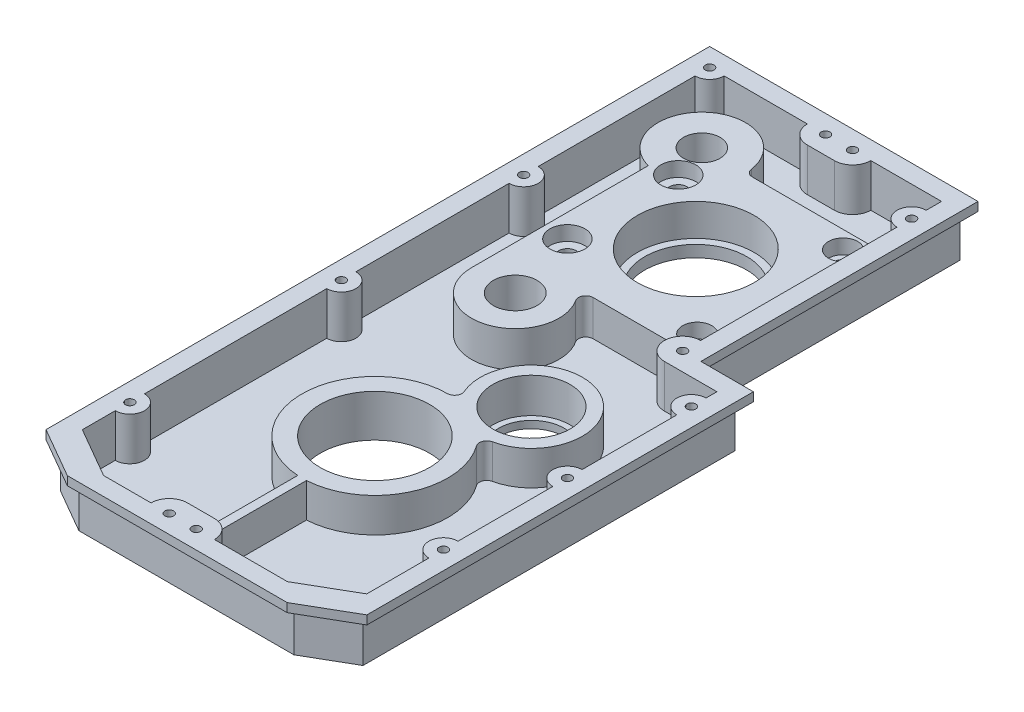
from build123d import *

# Parameters (mm, degrees)
SKETCH1_R           = 3
SKETCH1_R_2         = 12.5
SKETCH1_R_3         = 6
SKETCH1_R_4         = 37.5
SKETCH1_R_5         = 26.5
SKETCH1_R_6         = 35
BOSS_EXTRUDE1_DEPTH = 35
SKETCH1_6_R         = 6
SKETCH1_6_R_2       = 12.5
SKETCH1_6_R_3       = 35
CUT_EXTRUDE1_DEPTH  = 5
SKETCH1_7_R         = 15
CUT_EXTRUDE2_DEPTH  = 374.443770868
SKETCH1_8_R         = 40
SKETCH1_8_R_2       = 35
CUT_EXTRUDE3_DEPTH  = 27
BOSS_EXTRUDE2_START = -10
SKETCH1_10_R        = 3
BOSS_EXTRUDE2_DEPTH = 25
SKETCH1_11_R        = 10
SKETCH1_11_R_2      = 6
SKETCH1_11_R_3      = 12
CUT_EXTRUDE4_DEPTH  = 15
CUT_EXTRUDE6_DEPTH  = 29.5
BOSS_EXTRUDE3_START = -30
SKETCH1_15_R        = 26.5
SKETCH1_15_R_2      = 22.5
BOSS_EXTRUDE3_DEPTH = 5
SKETCH1_16_R        = 26.5
SKETCH1_16_R_2      = 37.5
CUT_EXTRUDE7_DEPTH  = 6
CUT_EXTRUDE8_DEPTH  = 10
CUT_EXTRUDE9_START  = -6
SKETCH2_OUTSIDE_W   = 326.928
SKETCH2_OUTSIDE_H   = 581.928
CUT_EXTRUDE9_DEPTH  = 368.443770868


with BuildPart() as part:
    # Sketch1 → Boss-Extrude1 (new body)
    with BuildSketch(Plane(origin=(0, 0, 0), x_dir=(1, 0, 0), z_dir=(0, 1, 0))):
        Polygon((73.5, 120), (-110.5, 120), (-110.5, -335), (-75.858983849, -355), (74.858983849, -355), (109.5, -335), (109.5, -70), (73.5, -70), align=None)
        with Locations(Location((0, -342.5, 0), (0, 0, 270))):
            Circle(SKETCH1_R, mode=Mode.SUBTRACT)
        with Locations(Location((-18.5, -342.5, 0), (0, 0, 270))):
            Circle(SKETCH1_R, mode=Mode.SUBTRACT)
        with Locations(Location((-98, -290, 0), (0, 0, 270))):
            Circle(SKETCH1_R, mode=Mode.SUBTRACT)
        with Locations(Location((-98, -145, 0), (0, 0, 270))):
            Circle(SKETCH1_R, mode=Mode.SUBTRACT)
        with BuildLine():
            ThreePointArc((97, -273), (94, -270), (97, -267))
            Line((97, -267), (97, -273))
        make_face(mode=Mode.SUBTRACT)
        with BuildLine():
            ThreePointArc((97, -188), (94, -185), (97, -182))
            Line((97, -182), (97, -188))
        make_face(mode=Mode.SUBTRACT)
        with BuildLine():
            ThreePointArc((97, -103), (94, -100), (97, -97))
            Line((97, -97), (97, -103))
        make_face(mode=Mode.SUBTRACT)
        with Locations(Location((-98, -20, 0), (0, 0, 270))):
            Circle(SKETCH1_R, mode=Mode.SUBTRACT)
        with Locations(Location((-98, 107.5, 0), (0, 0, 270))):
            Circle(SKETCH1_R, mode=Mode.SUBTRACT)
        with Locations(Location((-58, 62.14, 0), (0, 0, 270))):
            Circle(SKETCH1_R_2, mode=Mode.SUBTRACT)
        with Locations(Location((-18.5, 107.5, 0), (0, 0, 270))):
            Circle(SKETCH1_R, mode=Mode.SUBTRACT)
        with Locations(Location((51, -50, 0), (0, 0, 270))):
            Circle(SKETCH1_R_3, mode=Mode.SUBTRACT)
        with Locations(Location((0, 107.5, 0), (0, 0, 270))):
            Circle(SKETCH1_R, mode=Mode.SUBTRACT)
        with Locations(Location((51, 50, 0), (0, 0, 270))):
            Circle(SKETCH1_R_3, mode=Mode.SUBTRACT)
        with Locations(Location((61, 87, 0), (0, 0, 270))):
            Circle(SKETCH1_R, mode=Mode.SUBTRACT)
        with Locations(Location((0, -220, 0), (0, 0, 270))):
            Circle(SKETCH1_R_4, mode=Mode.SUBTRACT)
        with Locations(Location((36.32, -149, 0), (0, 0, 270))):
            Circle(SKETCH1_R_5, mode=Mode.SUBTRACT)
        with Locations(Location((0, 0, 0), (0, 0, 270))):
            Circle(SKETCH1_R_6, mode=Mode.SUBTRACT)
        with Locations(Location((-50, 38, 0), (0, 0, 270))):
            Circle(SKETCH1_R_3, mode=Mode.SUBTRACT)
        with Locations(Location((-50, -38, 0), (0, 0, 270))):
            Circle(SKETCH1_R_3, mode=Mode.SUBTRACT)
    extrude(amount=-BOSS_EXTRUDE1_DEPTH)

    # Sketch1<6> → Cut-Extrude1 (cut)
    with BuildSketch(Plane(origin=(0, 0, 0), x_dir=(1, 0, 0), z_dir=(0, 1, 0))):
        with BuildLine():
            Line((61, 62.14), (-23.358983849, 62.14))
            ThreePointArc((-23.358983849, 62.14), (-26.632252202, 63.36035527), (-28.307700442, 66.425714286))
            ThreePointArc((-28.307700442, 66.425714286), (-77.910527335, 84.580385497), (-65.79, 33.169050758))
            Line((-65.79, 33.169050758), (-65.79, -88))
            ThreePointArc((-65.79, -88), (-27.300080954, -116.773621159), (-10.59524836, -71.714285714))
            ThreePointArc((-10.59524836, -71.714285714), (-10.787673415, -66.609542781), (-6.396123087, -64))
            Line((-6.396123087, -64), (50.158901727, -64))
            ThreePointArc((50.158901727, -64), (54.717300076, -59.35229567), (61, -57.647058824))
            Line((61, -57.647058824), (61, 62.14))
        make_face()
        with Locations(Location((51, 50, 0), (0, 0, 270))):
            Circle(SKETCH1_6_R, mode=Mode.SUBTRACT)
        with Locations(Location((-58, 62.14, 0), (0, 0, 270))):
            Circle(SKETCH1_6_R_2, mode=Mode.SUBTRACT)
        with Locations(Location((51, -50, 0), (0, 0, 270))):
            Circle(SKETCH1_6_R, mode=Mode.SUBTRACT)
        with Locations(Location((0, 0, 0), (0, 0, 270))):
            Circle(SKETCH1_6_R_3, mode=Mode.SUBTRACT)
        with Locations(Location((-50, 38, 0), (0, 0, 270))):
            Circle(SKETCH1_6_R, mode=Mode.SUBTRACT)
        with Locations(Location((-50, -38, 0), (0, 0, 270))):
            Circle(SKETCH1_6_R, mode=Mode.SUBTRACT)
    extrude(amount=-CUT_EXTRUDE1_DEPTH, mode=Mode.SUBTRACT)

    # Sketch1<7> → Cut-Extrude2 (cut, through all)
    with BuildSketch(Plane(origin=(0, 0, 0), x_dir=(1, 0, 0), z_dir=(0, 1, 0))):
        with Locations(Location((-35.79, -88, 0), (0, 0, 270))):
            Circle(SKETCH1_7_R)
    extrude(amount=-CUT_EXTRUDE2_DEPTH, mode=Mode.SUBTRACT)

    # Sketch1<8> → Cut-Extrude3 (cut)
    with BuildSketch(Plane(origin=(0, 0, 0), x_dir=(1, 0, 0), z_dir=(0, 1, 0))):
        with Locations(Location((0, 0, 0), (0, 0, 270))):
            Circle(SKETCH1_8_R)
        with Locations(Location((0, 0, 0), (0, 0, 270))):
            Circle(SKETCH1_8_R_2, mode=Mode.SUBTRACT)
    extrude(amount=-CUT_EXTRUDE3_DEPTH, mode=Mode.SUBTRACT)

    # Sketch1<10> → Boss-Extrude2 (add)
    with BuildSketch(Plane(origin=(0, 0, 0), x_dir=(1, 0, 0), z_dir=(0, 1, 0)).offset(BOSS_EXTRUDE2_START)):
        with Locations(Location((0, 107.5, 0), (0, 0, 270))):
            Circle(SKETCH1_10_R)
        with Locations(Location((-18.5, 107.5, 0), (0, 0, 270))):
            Circle(SKETCH1_10_R)
        with Locations(Location((-98, 107.5, 0), (0, 0, 270))):
            Circle(SKETCH1_10_R)
        with Locations(Location((-98, -20, 0), (0, 0, 270))):
            Circle(SKETCH1_10_R)
        with BuildLine():
            Line((97, -103), (97, -97))
            ThreePointArc((97, -97), (94, -100), (97, -103))
        make_face()
        with BuildLine():
            Line((97, -188), (97, -182))
            ThreePointArc((97, -182), (94, -185), (97, -188))
        make_face()
        with Locations(Location((-98, -145, 0), (0, 0, 270))):
            Circle(SKETCH1_10_R)
        with BuildLine():
            Line((97, -273), (97, -267))
            ThreePointArc((97, -267), (94, -270), (97, -273))
        make_face()
        with Locations(Location((-98, -290, 0), (0, 0, 270))):
            Circle(SKETCH1_10_R)
        with Locations(Location((0, -342.5, 0), (0, 0, 270))):
            Circle(SKETCH1_10_R)
        with Locations(Location((-18.5, -342.5, 0), (0, 0, 270))):
            Circle(SKETCH1_10_R)
    extrude(amount=-BOSS_EXTRUDE2_DEPTH)

    # Sketch1<11> → Cut-Extrude4 (cut)
    # profile 1 of 4: a face of its own
    with BuildSketch(Plane(origin=(0, 0, 0), x_dir=(1, 0, 0), z_dir=(0, 1, 0))):
        with Locations(Location((51, -50, 0), (0, 0, 270))):
            Circle(SKETCH1_11_R)
        with Locations(Location((51, -50, 0), (0, 0, 270))):
            Circle(SKETCH1_11_R_2, mode=Mode.SUBTRACT)
    # profile 2 of 4: a face of its own
    with BuildSketch(Plane(origin=(0, 0, 0), x_dir=(1, 0, 0), z_dir=(0, 1, 0))):
        with Locations(Location((51, 50, 0), (0, 0, 270))):
            Circle(SKETCH1_11_R)
        with Locations(Location((51, 50, 0), (0, 0, 270))):
            Circle(SKETCH1_11_R_2, mode=Mode.SUBTRACT)
    # profile 3 of 4: a face of its own
    with BuildSketch(Plane(origin=(0, 0, 0), x_dir=(1, 0, 0), z_dir=(0, 1, 0))):
        with Locations(Location((-50, 38, 0), (0, 0, 270))):
            Circle(SKETCH1_11_R_3)
        with Locations(Location((-50, 38, 0), (0, 0, 270))):
            Circle(SKETCH1_11_R_2, mode=Mode.SUBTRACT)
    # profile 4 of 4: a face of its own
    with BuildSketch(Plane(origin=(0, 0, 0), x_dir=(1, 0, 0), z_dir=(0, 1, 0))):
        with Locations(Location((-50, -38, 0), (0, 0, 270))):
            Circle(SKETCH1_11_R_3)
        with Locations(Location((-50, -38, 0), (0, 0, 270))):
            Circle(SKETCH1_11_R_2, mode=Mode.SUBTRACT)
    extrude(amount=-CUT_EXTRUDE4_DEPTH, mode=Mode.SUBTRACT)

    # Sketch1<13> → Cut-Extrude6 (cut)
    with BuildSketch(Plane(origin=(0, 0, 0), x_dir=(1, 0, 0), z_dir=(0, 1, 0))):
        with BuildLine():
            Line((61, 97), (61, 107.5))
            Line((61, 107.5), (12.5, 107.5))
            ThreePointArc((12.5, 107.5), (8.838834765, 98.661165235), (0, 95))
            Line((0, 95), (-18.5, 95))
            ThreePointArc((-18.5, 95), (-27.338834765, 98.661165235), (-31, 107.5))
            Line((-31, 107.5), (-88, 107.5))
            ThreePointArc((-88, 107.5), (-90.928932188, 100.428932188), (-98, 97.5))
            Line((-98, 97.5), (-98, -10))
            ThreePointArc((-98, -10), (-90.928932188, -12.928932188), (-88, -20))
            ThreePointArc((-88, -20), (-90.928932188, -27.071067812), (-98, -30))
            Line((-98, -30), (-98, -135))
            ThreePointArc((-98, -135), (-90.928932188, -137.928932188), (-88, -145))
            ThreePointArc((-88, -145), (-90.928932188, -152.071067812), (-98, -155))
            Line((-98, -155), (-98, -280))
            ThreePointArc((-98, -280), (-90.928932188, -282.928932188), (-88, -290))
            ThreePointArc((-88, -290), (-90.928932188, -297.071067812), (-98, -300))
            Line((-98, -300), (-98, -322.586969212))
            Line((-98, -322.586969212), (-63.509618943, -342.5))
            Line((-63.509618943, -342.5), (-31, -342.5))
            ThreePointArc((-31, -342.5), (-27.338834765, -333.661165235), (-18.5, -330))
            Line((-18.5, -330), (-3, -330))
            Line((-3, -330), (-3, -269.909918854))
            ThreePointArc((-3, -269.909918854), (-49.981876169, -218.653874234), (-0.30922408, -170.000956204))
            ThreePointArc((-0.30922408, -170.000956204), (3.851641236, -167.726655553), (4.242371823, -163.000920347))
            ThreePointArc((4.242371823, -163.000920347), (52.259711789, -117.840321117), (43.73798762, -183.204874794))
            ThreePointArc((43.73798762, -183.204874794), (40.134538085, -186.287145885), (40.725181943, -190.992077708))
            ThreePointArc((40.725181943, -190.992077708), (45.110744804, -241.564338692), (3, -269.909918854))
            Line((3, -269.909918854), (3, -330.3653389))
            ThreePointArc((3, -330.3653389), (9.842509843, -334.794482496), (12.5, -342.5))
            Line((12.5, -342.5), (62.509618943, -342.5))
            Line((62.509618943, -342.5), (97, -322.586969212))
            Line((97, -322.586969212), (97, -280))
            ThreePointArc((97, -280), (87, -270), (97, -260))
            Line((97, -260), (97, -195))
            ThreePointArc((97, -195), (87, -185), (97, -175))
            Line((97, -175), (97, -110))
            ThreePointArc((97, -110), (87, -100), (97, -90))
            Line((97, -90), (97, -82.5))
            Line((97, -82.5), (61, -82.5))
            ThreePointArc((61, -82.5), (50.278766258, -76.356229336), (50.158901727, -64))
            Line((50.158901727, -64), (-6.396123087, -64))
            ThreePointArc((-6.396123087, -64), (-10.787673415, -66.609542781), (-10.59524836, -71.714285714))
            ThreePointArc((-10.59524836, -71.714285714), (-27.300080954, -116.773621159), (-65.79, -88))
            Line((-65.79, -88), (-65.79, 33.169050758))
            ThreePointArc((-65.79, 33.169050758), (-77.910527335, 84.580385497), (-28.307700442, 66.425714286))
            ThreePointArc((-28.307700442, 66.425714286), (-26.632252202, 63.36035527), (-23.358983849, 62.14))
            Line((-23.358983849, 62.14), (61, 62.14))
            Line((61, 62.14), (61, 77))
            ThreePointArc((61, 77), (51, 87), (61, 97))
        make_face()
    extrude(amount=-CUT_EXTRUDE6_DEPTH, mode=Mode.SUBTRACT)

    # Sketch1<15> → Boss-Extrude3 (add)
    with BuildSketch(Plane(origin=(0, 0, 0), x_dir=(1, 0, 0), z_dir=(0, 1, 0)).offset(BOSS_EXTRUDE3_START)):
        with Locations(Location((36.32, -149, 0), (0, 0, 270))):
            Circle(SKETCH1_15_R)
        with Locations(Location((36.32, -149, 0), (0, 0, 270))):
            Circle(SKETCH1_15_R_2, mode=Mode.SUBTRACT)
    extrude(amount=-BOSS_EXTRUDE3_DEPTH)

    # Sketch1<16> → Cut-Extrude7 (cut)
    # profile 1 of 2: a face of its own
    with BuildSketch(Plane(origin=(0, 0, 0), x_dir=(1, 0, 0), z_dir=(0, 1, 0))):
        with BuildLine():
            ThreePointArc((43.73798762, -183.204874794), (40.134538085, -186.287145885), (40.725181943, -190.992077708))
            ThreePointArc((40.725181943, -190.992077708), (-22.771016842, -264.513826975), (-0.30922408, -170.000956204))
            ThreePointArc((-0.30922408, -170.000956204), (3.851641236, -167.726655553), (4.242371823, -163.000920347))
            ThreePointArc((4.242371823, -163.000920347), (52.259711789, -117.840321117), (43.73798762, -183.204874794))
        make_face()
        with Locations(Location((36.32, -149, 0), (0, 0, 270))):
            Circle(SKETCH1_16_R, mode=Mode.SUBTRACT)
        with Locations(Location((0, -220, 0), (0, 0, 270))):
            Circle(SKETCH1_16_R_2, mode=Mode.SUBTRACT)
    # profile 2 of 2: a face of its own
    with BuildSketch(Plane(origin=(0, 0, 0), x_dir=(1, 0, 0), z_dir=(0, 1, 0))):
        with BuildLine():
            ThreePointArc((0, -330), (1.511081774, -330.091670867), (3, -330.3653389))
            Line((3, -330.3653389), (3, -269.909918854))
            ThreePointArc((3, -269.909918854), (0, -270), (-3, -269.909918854))
            Line((-3, -269.909918854), (-3, -330))
            Line((-3, -330), (0, -330))
        make_face()
    extrude(amount=-CUT_EXTRUDE7_DEPTH, mode=Mode.SUBTRACT)

    # Sketch1<17> → Cut-Extrude8 (cut)
    with BuildSketch(Plane(origin=(0, 0, 0), x_dir=(1, 0, 0), z_dir=(0, 1, 0))):
        with BuildLine():
            ThreePointArc((100, -100), (99.121320344, -97.878679656), (97, -97))
            Line((97, -97), (97, -103))
            ThreePointArc((97, -103), (99.121320344, -102.121320344), (100, -100))
        make_face()
        with BuildLine():
            Line((97, -103), (97, -97))
            ThreePointArc((97, -97), (94, -100), (97, -103))
        make_face()
        with BuildLine():
            ThreePointArc((100, -185), (99.121320344, -182.878679656), (97, -182))
            Line((97, -182), (97, -188))
            ThreePointArc((97, -188), (99.121320344, -187.121320344), (100, -185))
        make_face()
        with BuildLine():
            Line((97, -188), (97, -182))
            ThreePointArc((97, -182), (94, -185), (97, -188))
        make_face()
        with BuildLine():
            ThreePointArc((100, -270), (99.121320344, -267.878679656), (97, -267))
            Line((97, -267), (97, -273))
            ThreePointArc((97, -273), (99.121320344, -272.121320344), (100, -270))
        make_face()
        with BuildLine():
            Line((97, -273), (97, -267))
            ThreePointArc((97, -267), (94, -270), (97, -273))
        make_face()
        with BuildLine():
            ThreePointArc((64, -70), (63.121320344, -67.878679656), (61, -67))
            Line((61, -67), (61, -73))
            ThreePointArc((61, -73), (63.121320344, -72.121320344), (64, -70))
        make_face()
        with BuildLine():
            Line((61, -73), (61, -67))
            ThreePointArc((61, -67), (58, -70), (61, -73))
        make_face()
    extrude(amount=-CUT_EXTRUDE8_DEPTH, mode=Mode.SUBTRACT)

    # Sketch2 outside → Cut-Extrude9 (cut, through all)
    with BuildSketch(Plane(origin=(0, 0, 0), x_dir=(1, 0, 0), z_dir=(0, 1, 0)).offset(CUT_EXTRUDE9_START)):
        with Locations((-0.5, -117.5)):
            Rectangle(SKETCH2_OUTSIDE_W, SKETCH2_OUTSIDE_H)
        Polygon((-104.25, 113.75), (-104.25, -331.391560818), (-74.184301396, -348.75), (73.184301396, -348.75), (103.25, -331.391560818), (103.25, -76.25), (67.25, -76.25), (67.25, 113.75), align=None, mode=Mode.SUBTRACT)
    extrude(amount=-CUT_EXTRUDE9_DEPTH, mode=Mode.SUBTRACT)


solid = part.part
